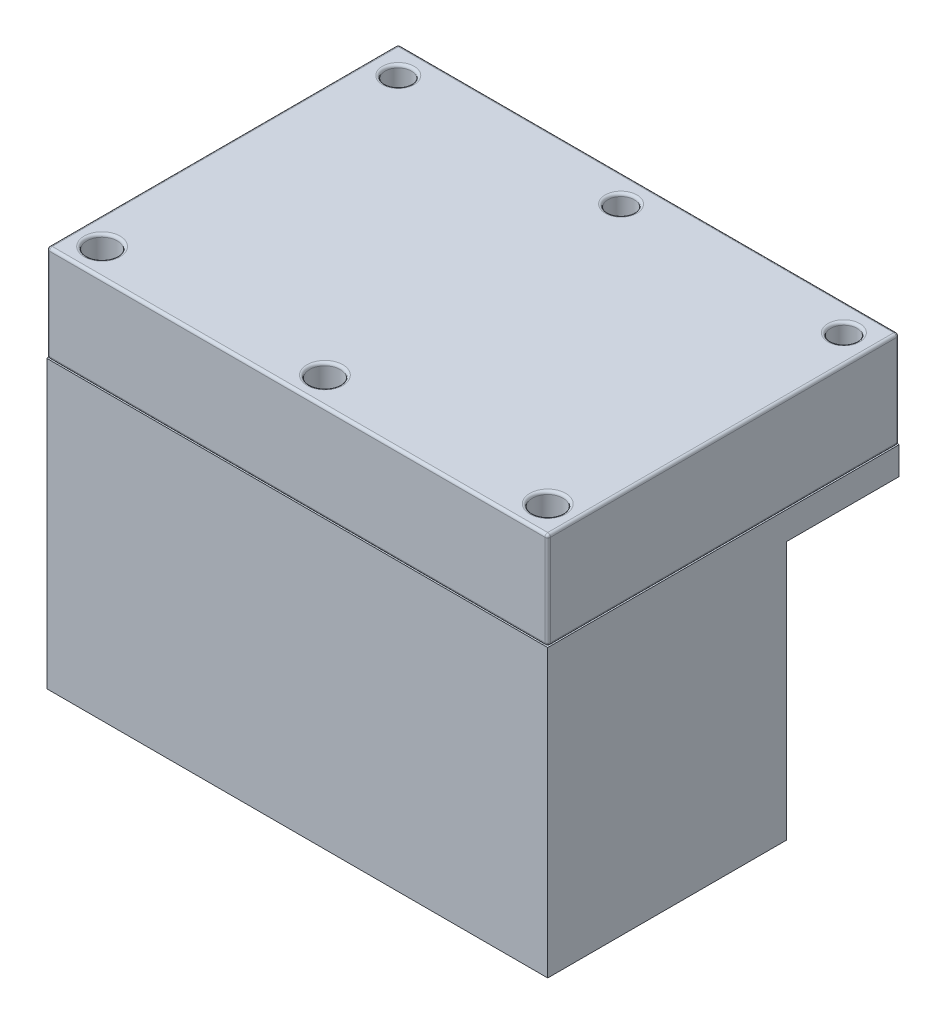
from build123d import *

# Parameters (mm, degrees)
SKETCH_1_W      = 26.2
SKETCH_1_H      = 15.4
SKETCH_1_R      = 1.5
EXTRUDE_1_DEPTH = 1.6
SKETCH_1_3_W    = 25
SKETCH_1_3_H    = 2.55
EXTRUDE_2_DEPTH = 2.65
SKETCH_2_W      = 0.628205128
SKETCH_2_H      = 3.5
EXTRUDE_3_DEPTH = 1.7
SKETCH_3_W      = 36.2
SKETCH_3_H      = 25.4
SKETCH_3_W_2    = 25.4
SKETCH_3_H_2    = 2.95
SKETCH_3_R      = 1.5
EXTRUDE_4_DEPTH = 2
SKETCH_4_W      = 36.2
SKETCH_4_H      = 25.4
SKETCH_4_R      = 1.1
SKETCH_4_W_2    = 28.2
SKETCH_4_H_2    = 17.4
SKETCH_4_R_2    = 0.95
EXTRUDE_5_DEPTH = 5
SKETCH_5_W      = 36.2
SKETCH_5_H      = 25.4
SKETCH_5_R      = 1.1
SKETCH_5_R_2    = 0.95
EXTRUDE_6_DEPTH = 2
EXTRUDE_START   = 18.68
SKETCH_6_R      = 1.5
EXTRUDE_8_DEPTH = 18.68
FILLET_1_R      = 0.2


with BuildPart() as part:
    # 스케치1 → 보스-돌출1 (new body)
    with BuildSketch(Plane(origin=(0, 0, 0), x_dir=(1, 0, 0), z_dir=(0, 1, 0))):
        Rectangle(SKETCH_1_W, SKETCH_1_H)
        with Locations((-10.15, -5.1)):
            Circle(SKETCH_1_R, mode=Mode.SUBTRACT)
        with Locations((10.15, -5.1)):
            Circle(SKETCH_1_R, mode=Mode.SUBTRACT)
    extrude(amount=EXTRUDE_1_DEPTH)

    # 스케치1<3> → 보스-돌출2 (add)
    with BuildSketch(Plane(origin=(0, 0, 0), x_dir=(1, 0, 0), z_dir=(0, 1, 0))):
        with Locations((0, 6.025)):
            Rectangle(SKETCH_1_3_W, SKETCH_1_3_H)
    extrude(amount=-EXTRUDE_2_DEPTH)

    # 스케치2 → 보스-돌출3 (add)
    with BuildSketch(Plane(origin=(0, 1.6, 0), x_dir=(1, 0, 0), z_dir=(0, 1, 0))):
        Polygon((0.5, -1.5), (-0.5, -1.5), (-0.5, -5.5), (-1.2, -5.5), (0, -6.930104311), (1.2, -5.5), (0.5, -5.5), align=None)
        Polygon((5.5, -1.2), (6.930104311, 0), (5.5, 1.2), (5.5, 0.5), (1.5, 0.5), (1.5, -0.5), (5.5, -0.5), align=None)
        with Locations((-3.28532471, 3.544331345)):
            Rectangle(SKETCH_2_W, SKETCH_2_H)
        Polygon((-1.886586729, 5.294331345), (-1.23454346, 5.294331345), (-0.435965736, 2.853025255), (0.368220963, 5.294331345), (1.013954136, 5.294331345), (1.605700931, 1.794331345), (0.969783463, 1.794331345), (0.596085547, 4.004968364), (-0.131678877, 1.794331345), (-0.744459325, 1.794331345), (-1.468017018, 4.004968364), (-1.841013812, 1.794331345), (-2.477632402, 1.794331345), align=None)
        with BuildLine():
            Line((2.189034264, 5.294331345), (2.817239393, 5.294331345))
            Line((2.817239393, 5.294331345), (2.817239393, 3.017087755))
            add(Edge.make_bspline(
                [(2.817239393, 3.017087755), (2.817273551, 2.993478281), (2.817339529, 2.947876826), (2.82064238, 2.882453669), (2.823664717, 2.822316089), (2.82911787, 2.767529925), (2.837174047, 2.71807174), (2.844975055, 2.673623833), (2.855532948, 2.634981994), (2.871399773, 2.590997464), (2.895845342, 2.541578443), (2.935788046, 2.490072805), (2.981878508, 2.443066435), (3.037120582, 2.403940113), (3.099207788, 2.372290446), (3.167798984, 2.348841544), (3.242797481, 2.335807069), (3.294654828, 2.333817117), (3.321345963, 2.332792883)],
                knots=[0, 0, 0, 0, 1.155499968, 2.231836252, 3.205919964, 4.102923608, 4.924856345, 5.658536265, 6.31071849, 6.882491295, 7.94666036, 8.992281882, 10.060072772, 11.158554251, 12.289267114, 13.461410017, 14.693379945, 16, 16, 16, 16], degree=3))
            add(Edge.make_bspline(
                [(3.321345963, 2.332792883), (3.349702001, 2.333620333), (3.404991473, 2.33523372), (3.484516578, 2.351070858), (3.558197038, 2.376289005), (3.624472787, 2.412281729), (3.68327787, 2.455425316), (3.733055141, 2.504622525), (3.772339181, 2.55997148), (3.797943056, 2.611035105), (3.812318371, 2.658034726), (3.823093386, 2.700027104), (3.830992664, 2.749573953), (3.838159148, 2.805901493), (3.842465653, 2.869593167), (3.847135356, 2.940136761), (3.848846846, 3.018014951), (3.849138556, 3.072242996), (3.849290675, 3.100521249)],
                knots=[0, 0, 0, 0, 1.261321664, 2.459363699, 3.594844139, 4.716940403, 5.803436589, 6.833651888, 7.818396249, 8.814403945, 9.360733334, 10.004355033, 10.743453831, 11.592799886, 12.532235708, 13.585170094, 14.740740724, 16, 16, 16, 16], degree=3))
            Line((3.849290675, 3.100521249), (3.849290675, 5.294331345))
            Line((3.849290675, 5.294331345), (4.477495803, 5.294331345))
            Line((4.477495803, 5.294331345), (4.477495803, 3.20639064))
            add(Edge.make_bspline(
                [(4.477495803, 3.20639064), (4.477408565, 3.164089061), (4.477240816, 3.08274725), (4.474664688, 2.965853344), (4.469180577, 2.859089511), (4.464574557, 2.762424556), (4.455660331, 2.675988702), (4.446373798, 2.599412843), (4.434537313, 2.532968347), (4.416925335, 2.457329363), (4.386532275, 2.370233842), (4.337534678, 2.269947127), (4.275335399, 2.171760357), (4.201818961, 2.076753656), (4.118812177, 1.988495493), (4.028155486, 1.91101625), (3.931289197, 1.845477164), (3.827201127, 1.793480747), (3.71597986, 1.752927462), (3.596524945, 1.725677696), (3.46891784, 1.707267413), (3.380777201, 1.705498879), (3.335368399, 1.704587755)],
                knots=[0, 0, 0, 0, 1.170808336, 2.251350247, 3.235597562, 4.129743112, 4.929140599, 5.639994148, 6.264258765, 6.79612947, 7.788252245, 8.809469599, 9.879094798, 10.999557536, 12.129761673, 13.226370002, 14.293821979, 15.358369427, 16.438775801, 17.562147481, 18.744053101, 20, 20, 20, 20], degree=3))
            add(Edge.make_bspline(
                [(3.335368399, 1.704587755), (3.305197888, 1.705095937), (3.245672088, 1.706098571), (3.158128956, 1.714939179), (3.073501323, 1.727966912), (2.991948202, 1.746973032), (2.913186538, 1.771525389), (2.837237257, 1.801747631), (2.764382604, 1.837471182), (2.695030264, 1.878367463), (2.62926558, 1.92258975), (2.569160054, 1.971612016), (2.512645313, 2.021808881), (2.461354044, 2.075292841), (2.414901005, 2.131502406), (2.373381866, 2.190564964), (2.33685831, 2.252475271), (2.304411607, 2.318349254), (2.276640395, 2.391535053), (2.253228221, 2.474635914), (2.232774795, 2.568954362), (2.217575015, 2.67470289), (2.203794806, 2.791532964), (2.195072693, 2.919748944), (2.190509763, 3.059354507), (2.189538525, 3.156140151), (2.189034264, 3.20639064)],
                knots=[0, 0, 0, 0, 1.001158378, 1.975264943, 2.917723546, 3.841610987, 4.75185031, 5.653588123, 6.552117133, 7.442167995, 8.324307438, 9.179605724, 10.014504199, 10.831958861, 11.636465792, 12.43274043, 13.225645099, 14.020104002, 14.867201867, 15.819789774, 16.883317127, 18.068162734, 19.364263498, 20.787406516, 22.332041935, 24, 24, 24, 24], degree=3))
            Line((2.189034264, 3.20639064), (2.189034264, 5.294331345))
        make_face()
        Polygon((1.779131112, -4.434974289), (2.226887522, -4.434974289), (2.66913178, -5.114665128), (3.112224061, -4.434974289), (3.560404483, -4.434974289), (2.893009985, -5.458538659), (3.604501705, -6.551640956), (3.156745295, -6.551640956), (2.66913178, -5.801988178), (2.18024623, -6.551640956), (1.732065808, -6.551640956), (2.445253575, -5.458114647), align=None)
        Polygon((6.501577719, -0.872404796), (6.924317436, -0.872404796), (7.302111907, -1.614849374), (7.679906378, -0.872404796), (8.102646095, -0.872404796), (7.492069172, -2.072358055), (7.492069172, -2.989071463), (7.112154642, -2.989071463), (7.112154642, -2.072358055), align=None)
    extrude(amount=EXTRUDE_3_DEPTH)


with BuildPart() as body_2:
    # 스케치3 → 보스-돌출4 (new body)
    with BuildSketch(Plane.XZ):
        Rectangle(SKETCH_3_W, SKETCH_3_H)
        with Locations((0, -6.025)):
            Rectangle(SKETCH_3_W_2, SKETCH_3_H_2, mode=Mode.SUBTRACT)
        with Locations((-10.15, 5.1)):
            Circle(SKETCH_3_R, mode=Mode.SUBTRACT)
        with Locations((10.15, 5.1)):
            Circle(SKETCH_3_R, mode=Mode.SUBTRACT)
    extrude(amount=EXTRUDE_4_DEPTH)

    # 스케치6 → 보스-돌출8 (add)
    with BuildSketch(Plane.XZ.offset(2).offset(EXTRUDE_START)):
        Polygon((-18.1, 12.7), (-18.1, -4.55), (-12.7, -4.55), (12.7, -4.55), (18.1, -4.55), (18.1, 12.7), align=None)
        with Locations((-10.15, 5.1)):
            Circle(SKETCH_6_R, mode=Mode.SUBTRACT)
        with Locations((10.15, 5.1)):
            Circle(SKETCH_6_R, mode=Mode.SUBTRACT)
    extrude(amount=-EXTRUDE_8_DEPTH)


with BuildPart() as body_3:
    # 스케치4 → 보스-돌출5 (new body)
    with BuildSketch(Plane(origin=(0, 0, 0), x_dir=(1, 0, 0), z_dir=(0, 1, 0))):
        Rectangle(SKETCH_4_W, SKETCH_4_H)
        with Locations((-16.1, -10.7)):
            Circle(SKETCH_4_R, mode=Mode.SUBTRACT)
        with Locations((0, -10.7)):
            Circle(SKETCH_4_R, mode=Mode.SUBTRACT)
        with Locations((16.1, -10.7)):
            Circle(SKETCH_4_R, mode=Mode.SUBTRACT)
        Rectangle(SKETCH_4_W_2, SKETCH_4_H_2, mode=Mode.SUBTRACT)
        with Locations((-16.1, 10.7)):
            Circle(SKETCH_4_R_2, mode=Mode.SUBTRACT)
        with Locations((0, 10.7)):
            Circle(SKETCH_4_R_2, mode=Mode.SUBTRACT)
        with Locations((16.1, 10.7)):
            Circle(SKETCH_4_R_2, mode=Mode.SUBTRACT)
    extrude(amount=EXTRUDE_5_DEPTH)

    # 스케치5 → 보스-돌출6 (add)
    with BuildSketch(Plane(origin=(0, 5, 0), x_dir=(1, 0, 0), z_dir=(0, 1, 0))):
        Rectangle(SKETCH_5_W, SKETCH_5_H)
        with Locations((-16.1, -10.7)):
            Circle(SKETCH_5_R, mode=Mode.SUBTRACT)
        with Locations((0, -10.7)):
            Circle(SKETCH_5_R, mode=Mode.SUBTRACT)
        with Locations((16.1, -10.7)):
            Circle(SKETCH_5_R, mode=Mode.SUBTRACT)
        with Locations((16.1, 10.7)):
            Circle(SKETCH_5_R_2, mode=Mode.SUBTRACT)
        with Locations((0, 10.7)):
            Circle(SKETCH_5_R_2, mode=Mode.SUBTRACT)
        with Locations((-16.1, 10.7)):
            Circle(SKETCH_5_R_2, mode=Mode.SUBTRACT)
    extrude(amount=EXTRUDE_6_DEPTH)

    # 필렛1
    fillet_1_edges = [body_3.edges().sort_by_distance(p)[0] for p in [
        (-14.1, 2.5, 8.7),
        (-14.1, 2.5, -8.7),
        (0, 0, 8.7),
        (-14.1, 0, 0),
        (0, 0, -8.7),
        (-18.1, 0, 0),
        (-18.1, 7, 0),
        (14.1, 2.5, -8.7),
        (14.1, 2.5, 8.7),
        (14.1, 0, 0),
        (0, 5, -8.7),
        (-14.1, 5, 0),
        (0, 5, 8.7),
        (14.1, 5, 0),
        (0, 7, -12.7),
        (-18.1, 3.5, -12.7),
        (0, 0, -12.7),
        (18.1, 7, 0),
        (18.1, 3.5, -12.7),
        (18.1, 0, 0),
        (-18.1, 3.5, 12.7),
        (0, 7, 12.7),
        (18.1, 3.5, 12.7),
        (0, 0, 12.7),
        (15, 0, 10.7),
        (-17.2, 0, 10.7),
        (-17.05, 0, -10.7),
        (15.15, 0, -10.7),
        (-0.95, 0, -10.7),
        (-1.1, 0, 10.7),
        (-17.05, 7, -10.7),
        (15.15, 7, -10.7),
        (-1.1, 7, 10.7),
        (-17.2, 7, 10.7),
        (15, 7, 10.7),
        (-0.95, 7, -10.7),
    ]]
    fillet(fillet_1_edges, radius=FILLET_1_R)


solid = Compound([part.part, body_2.part, body_3.part])
